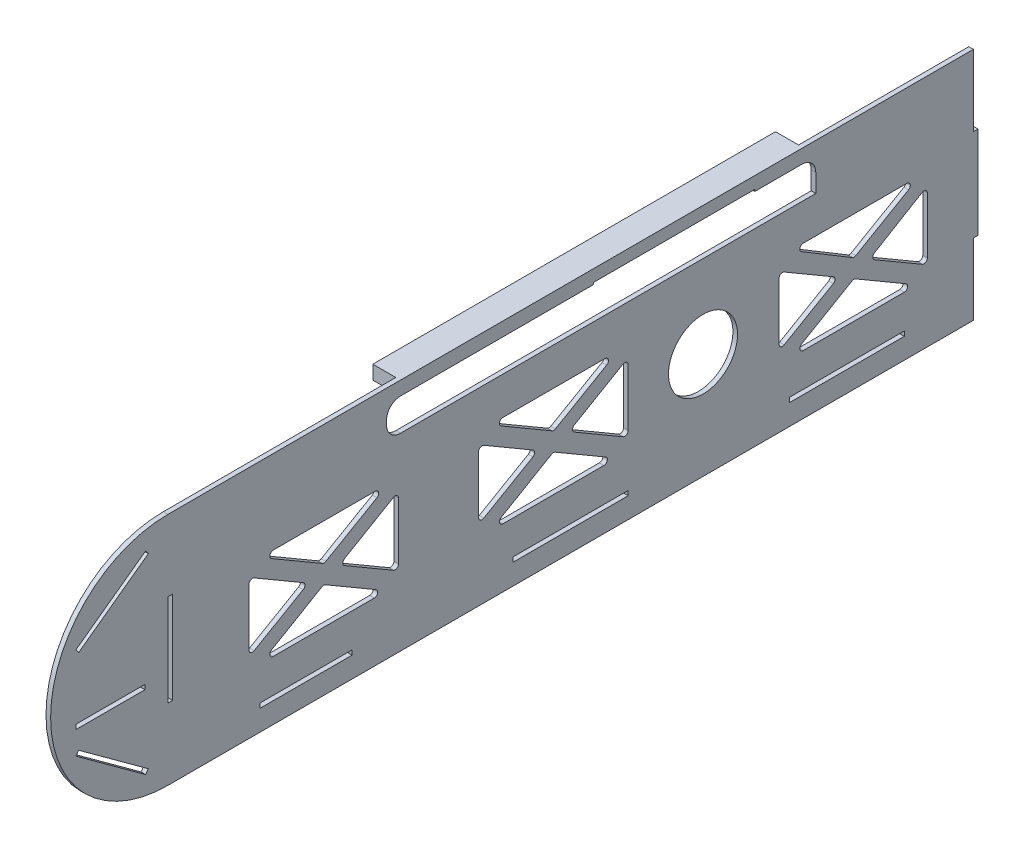
from build123d import *

# Parameters (mm, degrees)
SKETCH_1_W      = 2
SKETCH_1_H      = 40
SKETCH_1_W_2    = 40
SKETCH_1_H_2    = 2
SKETCH_1_W_3    = 50
SKETCH_1_R      = 15
SKETCH_1_W_4    = 30
EXTRUDE_3_DEPTH = 2
EXTRUDE_4_DEPTH = 10


with BuildPart() as part:
    # 草图1 → 凸台-拉伸3 (new body)
    with BuildSketch(Plane(origin=(0, 0, 0), x_dir=(0, 0, -1), z_dir=(1, 0, 0))):
        with BuildLine():
            ThreePointArc((0, 51), (-51, 0), (0, -51))
            Line((0, -51), (350, -51))
            Line((350, -51), (350, -20))
            Line((350, -20), (352, -20))
            Line((352, -20), (352, 20))
            Line((352, 20), (350, 20))
            Line((350, 20), (350, 51))
            Line((350, 51), (0, 51))
        make_face()
        with Locations((1, 0)):
            Rectangle(SKETCH_1_W, SKETCH_1_H, mode=Mode.SUBTRACT)
        with Locations((60, -41)):
            Rectangle(SKETCH_1_W_2, SKETCH_1_H_2, mode=Mode.SUBTRACT)
        with BuildLine():
            Line((35.191745563, -17.73919947), (35.191745563, 7.047932671))
            ThreePointArc((35.191745563, 7.047932671), (35.944654473, 8.3486459), (37.447552101, 8.343601023))
            Line((37.447552101, 8.343601023), (58.776761956, -4.098438059))
            ThreePointArc((58.776761956, -4.098438059), (59.520953252, -5.396654882), (58.772354967, -6.69233548))
            Line((58.772354967, -6.69233548), (37.443145112, -19.03742854))
            ThreePointArc((37.443145112, -19.03742854), (35.942445664, -19.038641528), (35.191745563, -17.73919947))
        make_face(mode=Mode.SUBTRACT)
        with BuildLine():
            Line((89.643364708, -25.34051183), (45.740126418, -25.34051183))
            ThreePointArc((45.740126418, -25.34051183), (44.292110098, -24.231981799), (44.98431988, -22.544843479))
            Line((44.98431988, -22.544843479), (66.935939025, -9.739732311))
            ThreePointArc((66.935939025, -9.739732311), (67.691745563, -9.535400662), (68.447552101, -9.739732311))
            Line((68.447552101, -9.739732311), (90.399171246, -22.544843479))
            ThreePointArc((90.399171246, -22.544843479), (91.091381028, -24.231981799), (89.643364708, -25.34051183))
        make_face(mode=Mode.SUBTRACT)
        with BuildLine():
            ThreePointArc((97.935939025, 8.343601023), (99.438836653, 8.3486459), (100.191745563, 7.047932671))
            Line((100.191745563, 7.047932671), (100.191745563, -17.728956331))
            ThreePointArc((100.191745563, -17.728956331), (99.438836653, -19.02966956), (97.935939025, -19.024624683))
            Line((97.935939025, -19.024624683), (76.698605594, -6.636180181))
            ThreePointArc((76.698605594, -6.636180181), (75.954412132, -5.34051183), (76.698605594, -4.044843479))
            Line((76.698605594, -4.044843479), (97.935939025, 8.343601023))
        make_face(mode=Mode.SUBTRACT)
        with BuildLine():
            Line((135, -17.73919947), (135, 7.047932671))
            ThreePointArc((135, 7.047932671), (135.75290891, 8.3486459), (137.255806538, 8.343601023))
            Line((137.255806538, 8.343601023), (158.585016393, -4.098438059))
            ThreePointArc((158.585016393, -4.098438059), (159.329207689, -5.396654882), (158.580609404, -6.69233548))
            Line((158.580609404, -6.69233548), (137.25139955, -19.03742854))
            ThreePointArc((137.25139955, -19.03742854), (135.750700102, -19.038641528), (135, -17.73919947))
        make_face(mode=Mode.SUBTRACT)
        with Locations((175, -41)):
            Rectangle(SKETCH_1_W_3, SKETCH_1_H_2, mode=Mode.SUBTRACT)
        with Locations((295, -41)):
            Rectangle(SKETCH_1_W_3, SKETCH_1_H_2, mode=Mode.SUBTRACT)
        with BuildLine():
            Line((189.451619145, -25.34051183), (145.548380855, -25.34051183))
            ThreePointArc((145.548380855, -25.34051183), (144.100364535, -24.231981799), (144.792574317, -22.544843479))
            Line((144.792574317, -22.544843479), (166.744193462, -9.739732311))
            ThreePointArc((166.744193462, -9.739732311), (167.5, -9.535400662), (168.255806538, -9.739732311))
            Line((168.255806538, -9.739732311), (190.207425683, -22.544843479))
            ThreePointArc((190.207425683, -22.544843479), (190.899635465, -24.231981799), (189.451619145, -25.34051183))
        make_face(mode=Mode.SUBTRACT)
        with BuildLine():
            ThreePointArc((197.744193462, 8.684112853), (199.24709109, 8.68915773), (200, 7.388444501))
            Line((200, 7.388444501), (200, -17.388444501))
            ThreePointArc((200, -17.388444501), (199.24709109, -18.68915773), (197.744193462, -18.684112853))
            Line((197.744193462, -18.684112853), (176.506860031, -6.295668351))
            ThreePointArc((176.506860031, -6.295668351), (175.762666569, -5), (176.506860031, -3.704331649))
            Line((176.506860031, -3.704331649), (197.744193462, 8.684112853))
        make_face(mode=Mode.SUBTRACT)
        with Locations((232.5, -5)):
            Circle(SKETCH_1_R, mode=Mode.SUBTRACT)
        with BuildLine():
            Line((319.974166797, -25.394327939), (276.070928507, -25.394327939))
            ThreePointArc((276.070928507, -25.394327939), (274.622912187, -24.285797907), (275.315121969, -22.598659587))
            Line((275.315121969, -22.598659587), (297.266741114, -9.793548419))
            ThreePointArc((297.266741114, -9.793548419), (298.022547652, -9.589216771), (298.778354191, -9.793548419))
            Line((298.778354191, -9.793548419), (320.729973336, -22.598659587))
            ThreePointArc((320.729973336, -22.598659587), (321.422183118, -24.285797907), (319.974166797, -25.394327939))
        make_face(mode=Mode.SUBTRACT)
        with BuildLine():
            Line((265.522547652, -17.793015579), (265.522547652, 6.994116563))
            ThreePointArc((265.522547652, 6.994116563), (266.275456563, 8.294829792), (267.778354191, 8.289784914))
            Line((267.778354191, 8.289784914), (289.107564045, -4.152254168))
            ThreePointArc((289.107564045, -4.152254168), (289.851755342, -5.45047099), (289.103157056, -6.746151588))
            Line((289.103157056, -6.746151588), (267.773947202, -19.091244648))
            ThreePointArc((267.773947202, -19.091244648), (266.273247754, -19.092457637), (265.522547652, -17.793015579))
        make_face(mode=Mode.SUBTRACT)
        with BuildLine():
            ThreePointArc((327.730104505, 8.28146303), (329.239985391, 8.298885363), (330, 6.994116563))
            Line((330, 6.994116563), (330, -17.477952976))
            ThreePointArc((330, -17.477952976), (329.24709109, -18.778666205), (327.744193462, -18.773621327))
            Line((327.744193462, -18.773621327), (307.029407683, -6.68999629))
            ThreePointArc((307.029407683, -6.68999629), (306.285236534, -5.40250951), (307.015318726, -4.106981472))
            Line((307.015318726, -4.106981472), (327.730104505, 8.28146303))
        make_face(mode=Mode.SUBTRACT)
        with BuildLine():
            ThreePointArc((44.98431988, 11.863819819), (44.292110098, 13.550958139), (45.740126418, 14.65948817))
            Line((45.740126418, 14.65948817), (90.076891362, 14.65948817))
            ThreePointArc((90.076891362, 14.65948817), (91.525570692, 13.548497422), (90.828290911, 11.861259101))
            Line((90.828290911, 11.861259101), (68.573204722, -1.019720173))
            ThreePointArc((68.573204722, -1.019720173), (67.819256701, -1.221488939), (67.065998635, -1.017159455))
            Line((67.065998635, -1.017159455), (44.98431988, 11.863819819))
        make_face(mode=Mode.SUBTRACT)
        with BuildLine():
            ThreePointArc((144.792574317, 11.863819819), (144.100364535, 13.550958139), (145.548380855, 14.65948817))
            Line((145.548380855, 14.65948817), (189.885145799, 14.65948817))
            ThreePointArc((189.885145799, 14.65948817), (191.333825129, 13.548497422), (190.636545348, 11.861259101))
            Line((190.636545348, 11.861259101), (168.381459159, -1.019720173))
            ThreePointArc((168.381459159, -1.019720173), (167.627511138, -1.221488939), (166.874253072, -1.017159455))
            Line((166.874253072, -1.017159455), (144.792574317, 11.863819819))
        make_face(mode=Mode.SUBTRACT)
        with BuildLine():
            ThreePointArc((275.298059327, 12.21443661), (274.625531488, 13.901032988), (276.070928507, 15))
            Line((276.070928507, 15), (321.088992758, 15))
            ThreePointArc((321.088992758, 15), (322.537672089, 13.889009252), (321.840392308, 12.20177093))
            Line((321.840392308, 12.20177093), (298.904006812, -1.073536282))
            ThreePointArc((298.904006812, -1.073536282), (298.140143671, -1.275255431), (297.379738082, -1.060870603))
            Line((297.379738082, -1.060870603), (275.298059327, 12.21443661))
        make_face(mode=Mode.SUBTRACT)
        with BuildLine():
            Line((95, 37), (95, 39))
            ThreePointArc((95, 39), (96.757359313, 43.242640687), (101, 45))
            Line((101, 45), (185, 45))
            Line((185, 45), (185, 45.8))
            Line((185, 45.8), (255, 45.8))
            Line((255, 45.8), (255, 45))
            Line((255, 45), (275.5, 45))
            ThreePointArc((275.5, 45), (279.742640687, 43.242640687), (281.5, 39))
            Line((281.5, 39), (281.5, 31))
            Line((281.5, 31), (101, 31))
            ThreePointArc((101, 31), (96.757359313, 32.757359313), (95, 37))
        make_face(mode=Mode.SUBTRACT)
        Polygon((-40, 20), (-9.698170842, 42.091834457), (-8.519939671, 40.475736902), (-38.821768829, 18.383902445), align=None, mode=Mode.SUBTRACT)
        with Locations((-25, -9)):
            Rectangle(SKETCH_1_W_4, SKETCH_1_H_2, mode=Mode.SUBTRACT)
        Polygon((-40, -20), (-38.821768829, -18.383902445), (-8.519939671, -40.475736902), (-9.698170842, -42.091834457), align=None, mode=Mode.SUBTRACT)
    extrude(amount=EXTRUDE_3_DEPTH)

    # 草图2 → 凸台-拉伸4 (add)
    with BuildSketch(Plane(origin=(0, 0, 0), x_dir=(0, 0, -1), z_dir=(1, 0, 0))):
        Polygon((101, 51), (101, 45), (185, 45), (185, 45.8), (255, 45.8), (255, 45), (276, 45), (276, 51), align=None)
    extrude(amount=-EXTRUDE_4_DEPTH)


solid = part.part
